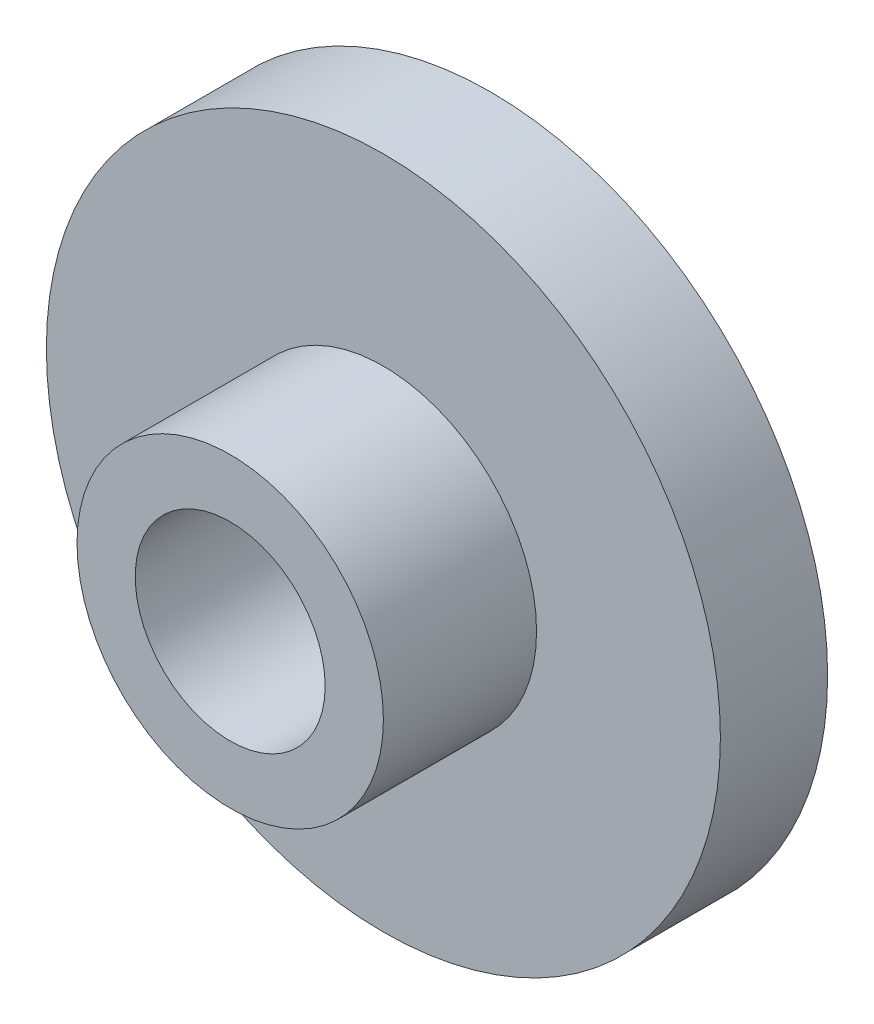
from build123d import *

# Parameters (mm, degrees)
SKETCH_1_R          = 11
EXTRUDE_1_DEPTH     = 3.5
SKETCH_2_R          = 5
EXTRUDE_2_DEPTH     = 5
SKETCH_3_R          = 3.1
CUT_EXTRUDE_1_DEPTH = 18.727097901


with BuildPart() as part:
    # 草图1 → 凸台-拉伸1 (new body)
    with BuildSketch(Plane.XY):
        Circle(SKETCH_1_R)
    extrude(amount=EXTRUDE_1_DEPTH)

    # 草图2 → 凸台-拉伸2 (add)
    with BuildSketch(Plane.XY.offset(3.5)):
        Circle(SKETCH_2_R)
    extrude(amount=EXTRUDE_2_DEPTH)

    # 草图3 → 切除-拉伸1 (cut, through all)
    with BuildSketch(Plane.XY.offset(8.5)):
        Circle(SKETCH_3_R)
    extrude(amount=-CUT_EXTRUDE_1_DEPTH, mode=Mode.SUBTRACT)


solid = part.part
